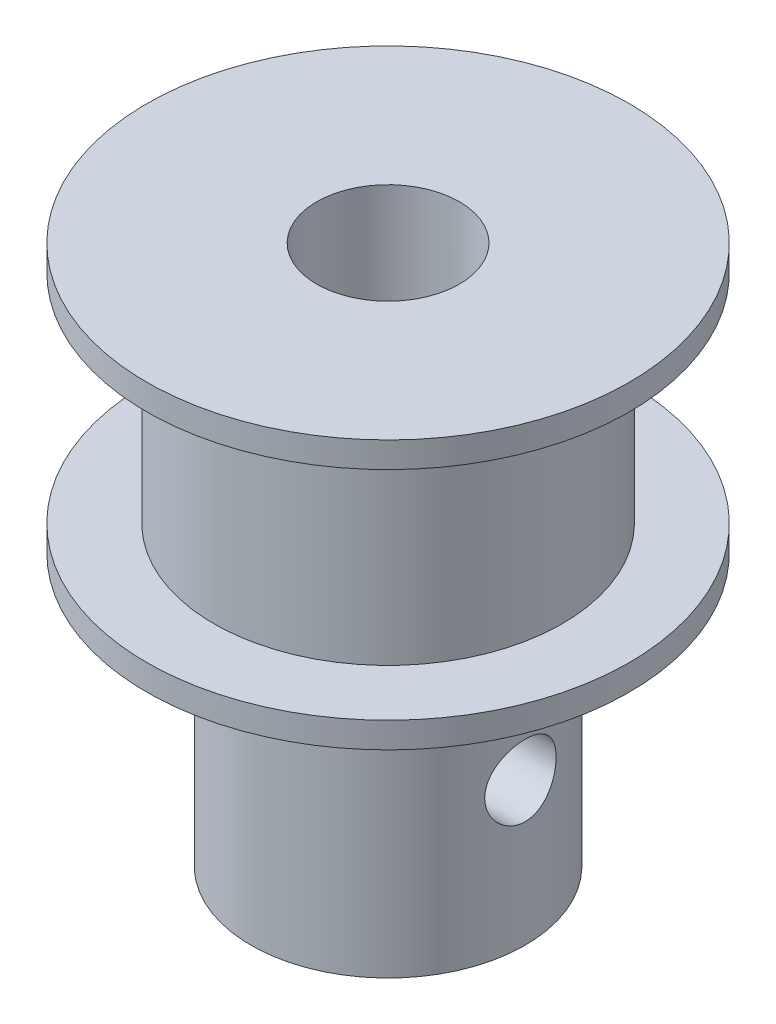
from build123d import *

# Parameters (mm, degrees)
CORTAR_EXTRUIR1_REACH      = 24.361
CORTAR_EXTRUIR1_END_RADIUS = 4.8
CROQUIS2_R                 = 1.25
MATRIZC1_COUNT             = 2
MATRIZC1_ANGLE             = 90


with BuildPart() as part:
    # Croquis1 → Revolución1 (revolve)
    with BuildSketch(Plane.XY, mode=Mode.PRIVATE) as revoluci_n1_sk:
        Polygon((8.45, 9.5), (4.8, 9.5), (4.8, 0), (2.5, 0), (2.5, 18.9), (8.45, 18.9), (8.45, 18), (6.1, 18), (6.1, 10.4), (8.45, 10.4), align=None)
    revolve(revoluci_n1_sk.sketch.rotate(Axis((0, 0, 0), (0, 1, 0)), 90), axis=Axis((0, 0, 0), (0, 1, 0)))

    # Cortar-Extruir1: up to this cylinder (the profile starts inside it)
    cortar_extruir1_end = Plane(origin=(0, 5, 0), z_dir=(0, -1, 0)) * Cylinder(CORTAR_EXTRUIR1_END_RADIUS, 59.322, mode=Mode.PRIVATE)
    # Croquis2 → Cortar-Extruir1 (cut, up to the surface)
    with BuildSketch(Plane.XY, mode=Mode.PRIVATE) as cortar_extruir1_sk1:
        with Locations((0, 5)):
            Circle(CROQUIS2_R)
    cortar_extruir1_tool1 = extrude(cortar_extruir1_sk1.sketch, amount=-CORTAR_EXTRUIR1_REACH, mode=Mode.PRIVATE) & cortar_extruir1_end
    cortar_extruir1 = cortar_extruir1_tool1.solids().sort_by_distance((0, 5, 0))[0]
    add(cortar_extruir1, mode=Mode.SUBTRACT)

    # MatrizC1: Cortar-Extruir1 ×2 about axis
    matrizc1_axis = Axis((0, 0, 0), (0, -1, 0))
    for i in range(1, MATRIZC1_COUNT):
        add(cortar_extruir1.rotate(matrizc1_axis, i * MATRIZC1_ANGLE / (MATRIZC1_COUNT - 1)), mode=Mode.SUBTRACT)


solid = part.part
